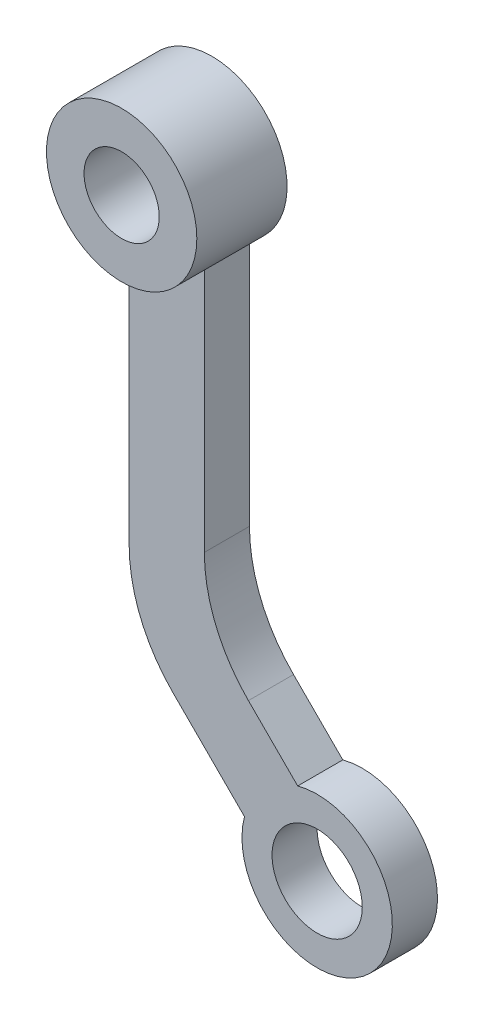
from build123d import *

# Parameters (mm, degrees)
SKETCH1_R           = 1.5
BOSS_EXTRUDE1_DEPTH = 1.5
SKETCH1_3_R         = 1.25
BOSS_EXTRUDE2_DEPTH = 3


with BuildPart() as part:
    # Sketch1 → Boss-Extrude1 (new body)
    with BuildSketch(Plane.XY):
        with BuildLine():
            Line((-3.75, 7.588834765), (-3.75, 15.834936491))
            ThreePointArc((-3.75, 15.834936491), (-5, 15.5), (-6.25, 15.834936491))
            Line((-6.25, 15.834936491), (-6.25, 6.553300859))
            ThreePointArc((-6.25, 6.553300859), (-5.869397663, 4.639883697), (-4.785533906, 3.017766953))
            Line((-4.785533906, 3.017766953), (-2.414814566, 0.647047613))
            ThreePointArc((-2.414814566, 0.647047613), (1.767766953, -1.767766953), (-0.647047613, 2.414814566))
            Line((-0.647047613, 2.414814566), (-2.285533906, 4.053300859))
            ThreePointArc((-2.285533906, 4.053300859), (-3.369397663, 5.675417603), (-3.75, 7.588834765))
        make_face()
        Circle(SKETCH1_R, mode=Mode.SUBTRACT)
    extrude(amount=BOSS_EXTRUDE1_DEPTH)

    # Sketch1<3> → Boss-Extrude2 (add)
    with BuildSketch(Plane.XY):
        with BuildLine():
            ThreePointArc((-6.25, 15.834936491), (-5, 15.5), (-3.75, 15.834936491))
            ThreePointArc((-3.75, 15.834936491), (-2.834936491, 16.75), (-2.5, 18))
            ThreePointArc((-2.5, 18), (-6.25, 20.165063509), (-6.25, 15.834936491))
        make_face()
        with Locations((-5, 18)):
            Circle(SKETCH1_3_R, mode=Mode.SUBTRACT)
    extrude(amount=BOSS_EXTRUDE2_DEPTH)


solid = part.part
